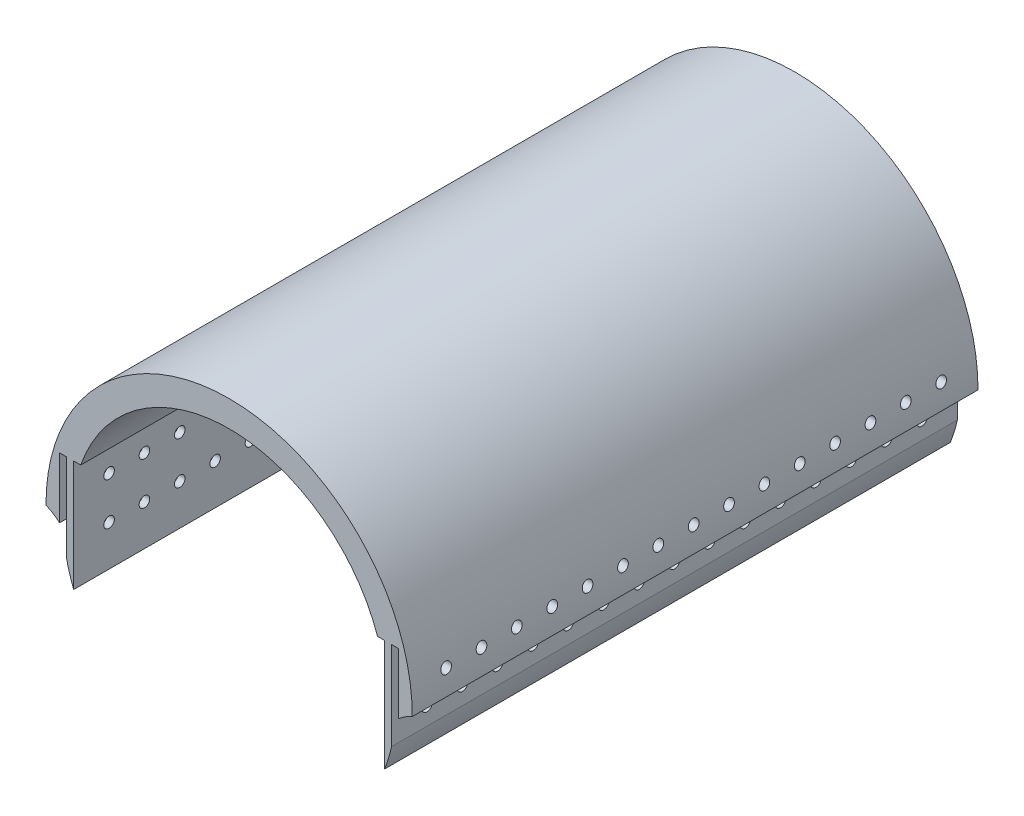
from build123d import *

# Parameters (mm, degrees)
BOSS_EXTRUDE1_DEPTH     = 160
CUT_EXTRUDE1_DEPTH      = 194.495047723
CUT_EXTRUDE1_DEPTH_BACK = 194.495047723
SKETCH2_R               = 1.5


with BuildPart() as part:
    # Sketch1 → Boss-Extrude1 (new body)
    with BuildSketch(Plane.XY):
        with BuildLine():
            Line((41.961950208, 14.419511727), (43.961950208, 14.419511727))
            Line((43.961950208, 14.419511727), (43.961950208, -17.081994407))
            ThreePointArc((43.961950208, -17.081994407), (45.079311907, -13.867344267), (45.961950208, -10.580488273))
            Line((45.961950208, -10.580488273), (45.961950208, 14.419511727))
            Line((45.961950208, 14.419511727), (47.961950208, 14.419511727))
            Line((47.961950208, 14.419511727), (47.961950208, -2.745639423))
            ThreePointArc((47.961950208, -2.745639423), (49.776897881, -1.373081192), (51.790252816, -0.312726035))
            ThreePointArc((51.790252816, -0.312726035), (0, 51.689134821), (-51.790252816, -0.312726035))
            ThreePointArc((-51.790252816, -0.312726035), (-49.776897881, -1.373081192), (-47.961950208, -2.745639423))
            Line((-47.961950208, -2.745639423), (-47.961950208, 14.419511727))
            Line((-47.961950208, 14.419511727), (-45.961950208, 14.419511727))
            Line((-45.961950208, 14.419511727), (-45.961950208, -10.580488273))
            ThreePointArc((-45.961950208, -10.580488273), (-45.079311907, -13.867344267), (-43.961950208, -17.081994407))
            Line((-43.961950208, -17.081994407), (-43.961950208, 14.419511727))
            Line((-43.961950208, 14.419511727), (-41.961950208, 14.419511727))
            ThreePointArc((-41.961950208, 14.419511727), (0, 44.301902416), (41.961950208, 14.419511727))
        make_face()
    extrude(amount=BOSS_EXTRUDE1_DEPTH)

    # Sketch2 → Cut-Extrude1 (cut, two sides: drawn at the far end of the back side and taken through both)
    with BuildSketch(Plane.ZY.offset(-43.961950208).offset(-CUT_EXTRUDE1_DEPTH_BACK)):
        with Locations((10, 6.419511727)):
            Circle(SKETCH2_R)
        with Locations((10, -5.580488273)):
            Circle(SKETCH2_R)
        with Locations((20, 6.419511727)):
            Circle(SKETCH2_R)
        with Locations((20, -5.580488273)):
            Circle(SKETCH2_R)
        with Locations((30, 6.419511727)):
            Circle(SKETCH2_R)
        with Locations((30, -5.580488273)):
            Circle(SKETCH2_R)
        with Locations((40, 6.419511727)):
            Circle(SKETCH2_R)
        with Locations((40, -5.580488273)):
            Circle(SKETCH2_R)
        with Locations((50, 6.419511727)):
            Circle(SKETCH2_R)
        with Locations((50, -5.580488273)):
            Circle(SKETCH2_R)
        with Locations((60, 6.419511727)):
            Circle(SKETCH2_R)
        with Locations((60, -5.580488273)):
            Circle(SKETCH2_R)
        with Locations((70, 6.419511727)):
            Circle(SKETCH2_R)
        with Locations((70, -5.580488273)):
            Circle(SKETCH2_R)
        with Locations((80, 6.419511727)):
            Circle(SKETCH2_R)
        with Locations((80, -5.580488273)):
            Circle(SKETCH2_R)
        with Locations((90, 6.419511727)):
            Circle(SKETCH2_R)
        with Locations((90, -5.580488273)):
            Circle(SKETCH2_R)
        with Locations((100, 6.419511727)):
            Circle(SKETCH2_R)
        with Locations((100, -5.580488273)):
            Circle(SKETCH2_R)
        with Locations((110, 6.419511727)):
            Circle(SKETCH2_R)
        with Locations((110, -5.580488273)):
            Circle(SKETCH2_R)
        with Locations((120, 6.419511727)):
            Circle(SKETCH2_R)
        with Locations((120, -5.580488273)):
            Circle(SKETCH2_R)
        with Locations((130, 6.419511727)):
            Circle(SKETCH2_R)
        with Locations((130, -5.580488273)):
            Circle(SKETCH2_R)
        with Locations((140, 6.419511727)):
            Circle(SKETCH2_R)
        with Locations((140, -5.580488273)):
            Circle(SKETCH2_R)
        with Locations((150, 6.419511727)):
            Circle(SKETCH2_R)
        with Locations((150, -5.580488273)):
            Circle(SKETCH2_R)
    extrude(amount=CUT_EXTRUDE1_DEPTH + CUT_EXTRUDE1_DEPTH_BACK, mode=Mode.SUBTRACT)


solid = part.part
